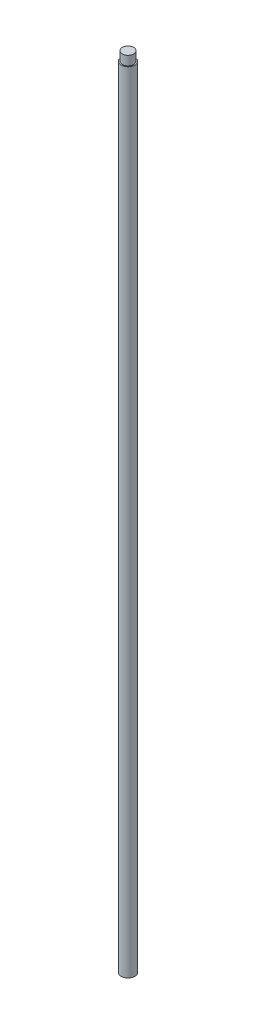
from build123d import *

# Parameters (mm, degrees)
SKETCH1_R      = 6
EXTRUDE1_DEPTH = 700
SKETCH2_R      = 6
SKETCH2_R_2    = 5
EXTRUDE2_DEPTH = 8


with BuildPart() as part:
    # Sketch1 → Extrude1 (new body)
    with BuildSketch(Plane(origin=(0, 0, 0), x_dir=(1, 0, 0), z_dir=(0, 1, 0))):
        with Locations(Location((0, 0, 0), (0, 0, 270))):
            Circle(SKETCH1_R)
    extrude(amount=-EXTRUDE1_DEPTH)

    # Sketch2 → Extrude2 (cut)
    with BuildSketch(Plane(origin=(0, 0, 0), x_dir=(1, 0, 0), z_dir=(0, 1, 0))):
        with Locations(Location((0, 0, 0), (0, 0, 270))):
            Circle(SKETCH2_R)
        with Locations(Location((0, 0, 0), (0, 0, 270))):
            Circle(SKETCH2_R_2, mode=Mode.SUBTRACT)
    extrude(amount=-EXTRUDE2_DEPTH, mode=Mode.SUBTRACT)


solid = part.part
